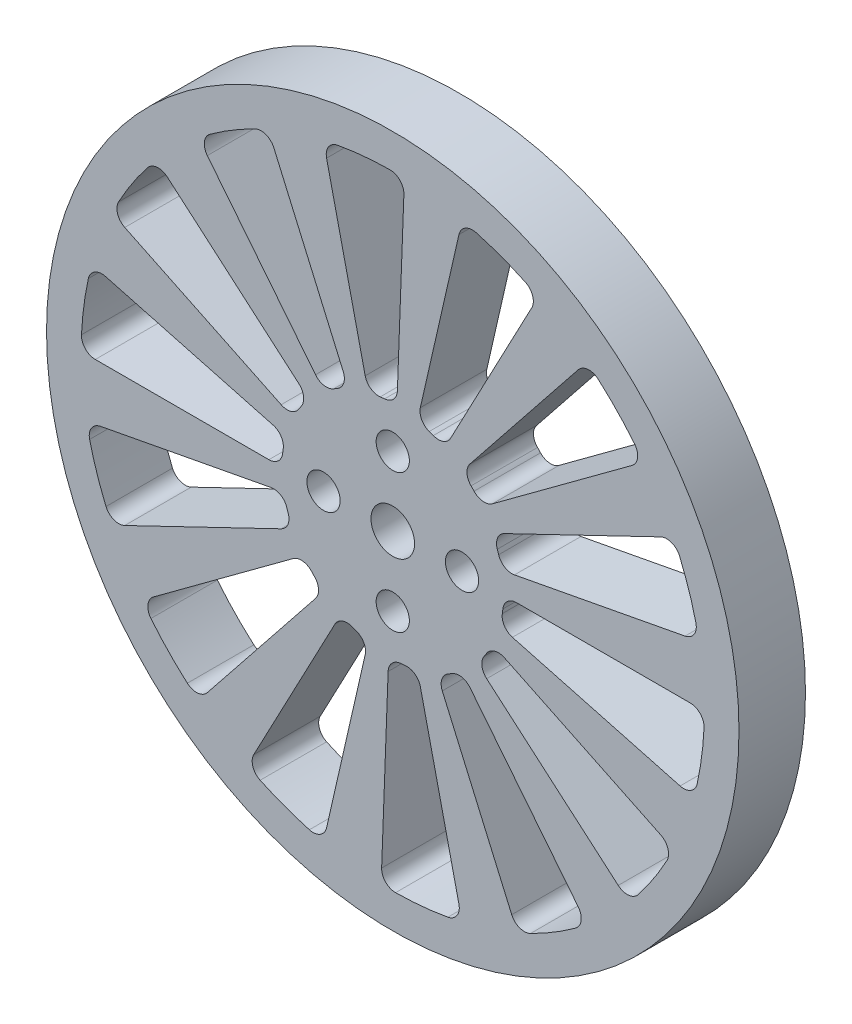
from build123d import *

# Parameters (mm, degrees)
SKETCH1_R           = 31.75
SKETCH1_R_2         = 1.524
SKETCH1_R_3         = 2
BOSS_EXTRUDE1_DEPTH = 6.096
CUT_EXTRUDE1_REACH  = 47.313
CIRPATTERN1_COUNT   = 14


with BuildPart() as part:
    # Sketch1 → Boss-Extrude1 (new body)
    with BuildSketch(Plane.XY):
        Circle(SKETCH1_R)
        with Locations((0, 6.35)):
            Circle(SKETCH1_R_2, mode=Mode.SUBTRACT)
        with Locations((6.35, 0)):
            Circle(SKETCH1_R_2, mode=Mode.SUBTRACT)
        with Locations((0, -6.35)):
            Circle(SKETCH1_R_2, mode=Mode.SUBTRACT)
        with Locations((-6.35, 0)):
            Circle(SKETCH1_R_2, mode=Mode.SUBTRACT)
        Circle(SKETCH1_R_3, mode=Mode.SUBTRACT)
    extrude(amount=BOSS_EXTRUDE1_DEPTH)

    # Sketch2 → Cut-Extrude1 (cut, up to next)
    with BuildSketch(Plane.XY.offset(6.096), mode=Mode.PRIVATE) as cut_extrude1_sk1:
        with BuildLine():
            Line((-27.275449126, 0), (-11.359225326, 0))
            ThreePointArc((-11.359225326, 0), (-10.512558659, 0.32339789), (-10.097089178, 1.128888889))
            ThreePointArc((-10.097089178, 1.128888889), (-10.073079792, 1.326146113), (-10.045217152, 1.522896047))
            ThreePointArc((-10.045217152, 1.522896047), (-10.238053442, 2.40847202), (-10.972169109, 2.939983852))
            Line((-10.972169109, 2.939983852), (-26.346060734, 7.059405697))
            ThreePointArc((-26.346060734, 7.059405697), (-27.335173973, 6.917463102), (-27.915447476, 6.103967335))
            ThreePointArc((-27.915447476, 6.103967335), (-28.330536914, 3.729785943), (-28.544074666, 1.329069767))
            ThreePointArc((-28.544074666, 1.329069767), (-28.194121702, 0.393107363), (-27.275449126, 0))
        make_face()
    cut_extrude1_tool1 = extrude(cut_extrude1_sk1.sketch, amount=-CUT_EXTRUDE1_REACH, mode=Mode.PRIVATE) & part.part
    cut_extrude1 = cut_extrude1_tool1.solids().sort_by_distance((-20.595833, 2.711493, 6.096))[0]
    add(cut_extrude1, mode=Mode.SUBTRACT)

    # CirPattern1: Cut-Extrude1 ×14 about axis
    cirpattern1_axis = Axis((0, 0, 6.096), (0, 0, -1))
    for i in range(1, CIRPATTERN1_COUNT):
        add(cut_extrude1.rotate(cirpattern1_axis, i * 360 / CIRPATTERN1_COUNT), mode=Mode.SUBTRACT)


solid = part.part
